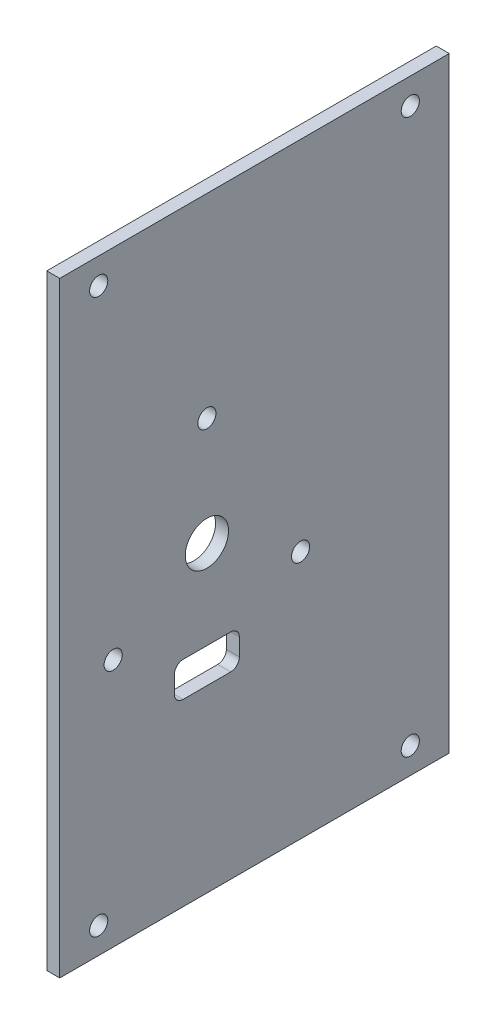
from build123d import *

# Parameters (mm, degrees)
SKETCH1_W           = 90
SKETCH1_H           = 140
SKETCH1_R           = 5
SKETCH1_R_2         = 2.1
BOSS_EXTRUDE1_DEPTH = 3


with BuildPart() as part:
    # Sketch1 → Boss-Extrude1 (new body)
    with BuildSketch(Plane(origin=(0, 0, 0), x_dir=(0, 0, -1), z_dir=(1, 0, 0))):
        with Locations((45, -70)):
            Rectangle(SKETCH1_W, SKETCH1_H)
        with Locations((34, -70)):
            Circle(SKETCH1_R, mode=Mode.SUBTRACT)
        with Locations((34, -45)):
            Circle(SKETCH1_R_2, mode=Mode.SUBTRACT)
        with Locations((55.650635095, -82.5)):
            Circle(SKETCH1_R_2, mode=Mode.SUBTRACT)
        with Locations((12.349364905, -82.5)):
            Circle(SKETCH1_R_2, mode=Mode.SUBTRACT)
        with Locations((9, -6)):
            Circle(SKETCH1_R_2, mode=Mode.SUBTRACT)
        with Locations(Location((81, -6, 0), (0, 0, 180))):
            Circle(SKETCH1_R_2, mode=Mode.SUBTRACT)
        with Locations((81, -134)):
            Circle(SKETCH1_R_2, mode=Mode.SUBTRACT)
        with Locations(Location((9, -134, 0), (0, 0, 180))):
            Circle(SKETCH1_R_2, mode=Mode.SUBTRACT)
        with BuildLine():
            Line((34, -90.5), (28.5, -90.5))
            ThreePointArc((28.5, -90.5), (27.085786438, -91.085786438), (26.5, -92.5))
            Line((26.5, -92.5), (26.5, -96.5))
            ThreePointArc((26.5, -96.5), (27.085786438, -97.914213562), (28.5, -98.5))
            Line((28.5, -98.5), (39.5, -98.5))
            ThreePointArc((39.5, -98.5), (40.914213562, -97.914213562), (41.5, -96.5))
            Line((41.5, -96.5), (41.5, -92.5))
            ThreePointArc((41.5, -92.5), (40.914213562, -91.085786438), (39.5, -90.5))
            Line((39.5, -90.5), (34, -90.5))
        make_face(mode=Mode.SUBTRACT)
    extrude(amount=BOSS_EXTRUDE1_DEPTH)


solid = part.part
